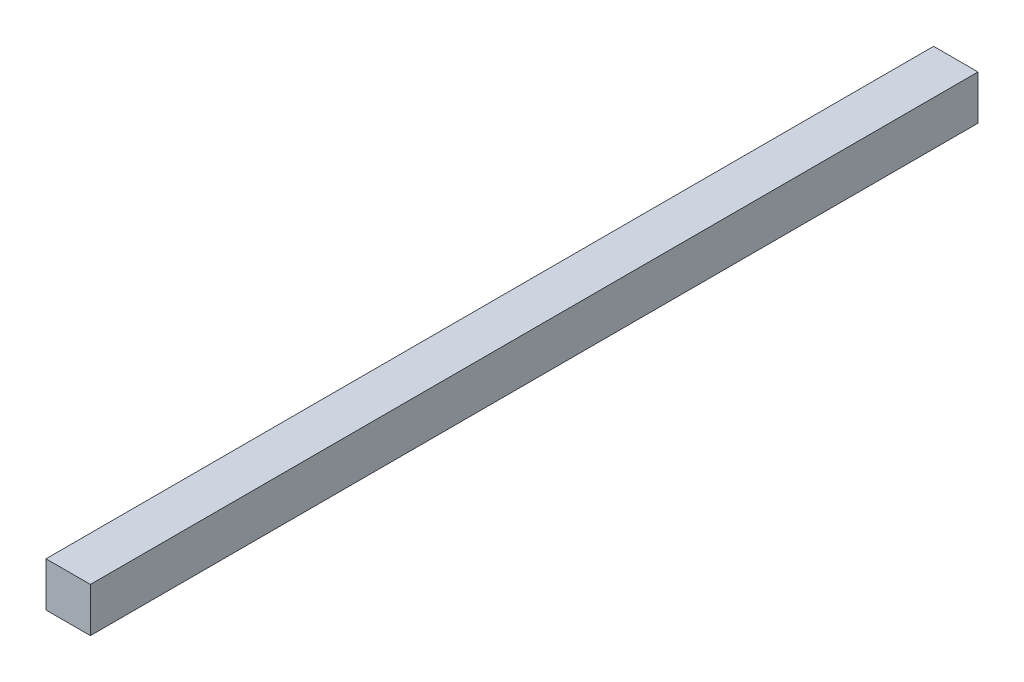
from build123d import *

# Parameters (mm, degrees)
SKETCH1_W           = 5
SKETCH1_H           = 5
BOSS_EXTRUDE1_DEPTH = 100


with BuildPart() as part:
    # Sketch1 → Boss-Extrude1 (new body)
    with BuildSketch(Plane.XY):
        Rectangle(SKETCH1_W, SKETCH1_H)
    extrude(amount=BOSS_EXTRUDE1_DEPTH)


solid = part.part
